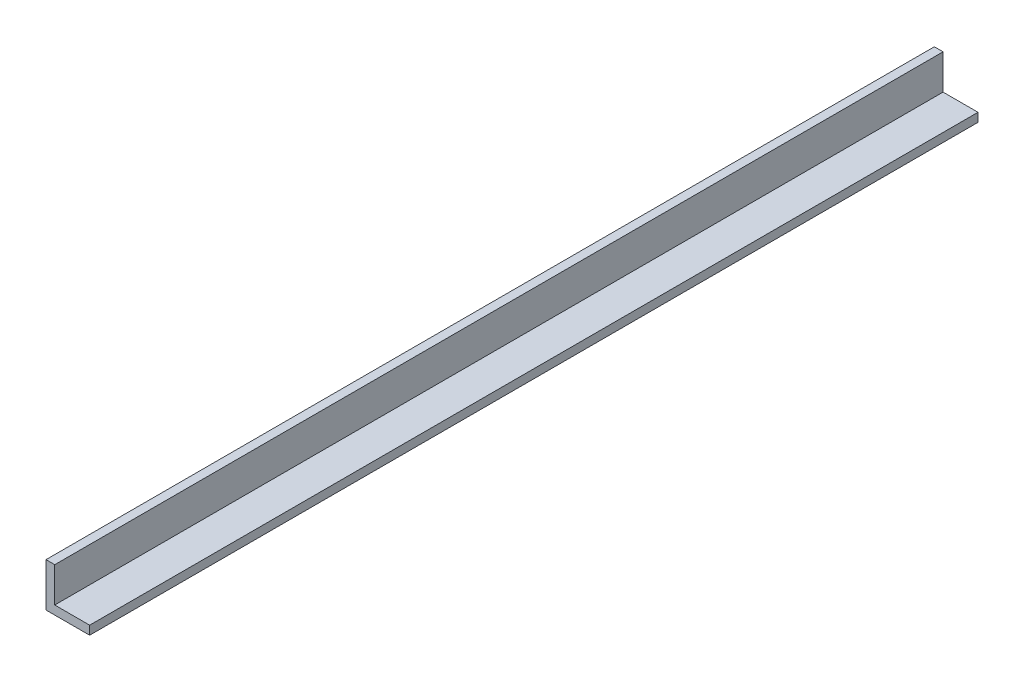
from build123d import *

# Parameters (mm, degrees)
EXTRUDE_1_DEPTH = 407


with BuildPart() as part:
    # Эскиз1 → Бобышка-Вытянуть1 (new body)
    with BuildSketch(Plane.XY):
        Polygon((-10, 20), (-10, 0), (10, 0), (10, 4), (-6, 4), (-6, 20), align=None)
    extrude(amount=EXTRUDE_1_DEPTH)


solid = part.part
